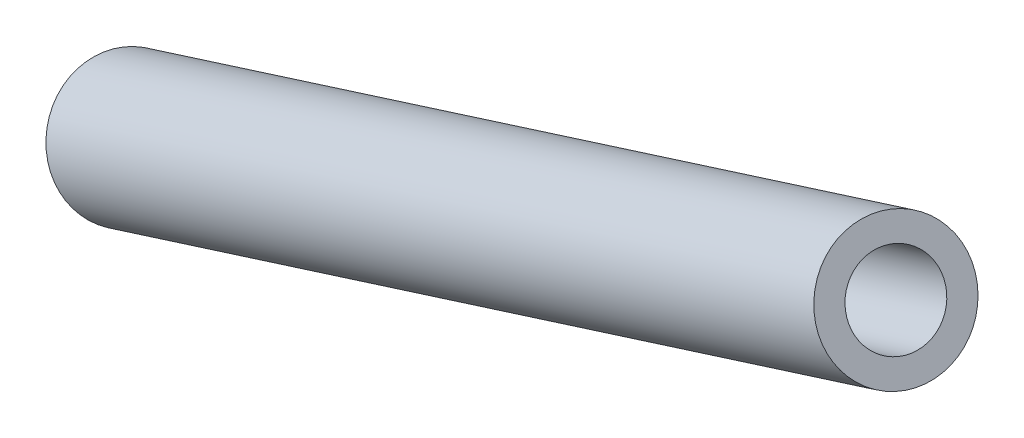
from build123d import *

# Parameters (mm, degrees)
SLIDING_SLEEVE_OUTSIDE_SKETCH_R = 2.5
SLIDING_SLEEVE_OUTSIDE_DEPTH    = 46.364941753
SLIDING_SLEEVE_BORE_SKETCH_R    = 1.55
SLIDING_SLEEVE_BORE_DEPTH       = 46.564941753


with BuildPart() as part:
    # Sliding sleeve outside sketch → Sliding sleeve outside (new body)
    with BuildSketch(Plane(origin=(-55.335742198, -27.677379212, -14.827167434), x_dir=(-0.20842845999452608, -0.1042500434014437, 0.9724656834640014), z_dir=(-0.8697399638531155, -0.43501942576382596, -0.23304612093938112))):
        with Locations(Location((13.090181548, -53.527480937, 0), (0, 0, 270))):
            Circle(SLIDING_SLEEVE_OUTSIDE_SKETCH_R)
    extrude(amount=SLIDING_SLEEVE_OUTSIDE_DEPTH)

    # Sliding sleeve bore sketch → Sliding sleeve bore (cut)
    with BuildSketch(Plane(origin=(-55.248768201, -27.633877269, -14.803862822), x_dir=(-0.20842845999452578, -0.10425004340144366, 0.9724656834640014), z_dir=(-0.8697399638531152, -0.43501942576382663, -0.23304612093938087))):
        with Locations(Location((13.090181548, -53.527480937, 0), (0, 0, 90))):
            Circle(SLIDING_SLEEVE_BORE_SKETCH_R)
    extrude(amount=SLIDING_SLEEVE_BORE_DEPTH, mode=Mode.SUBTRACT)


solid = part.part
